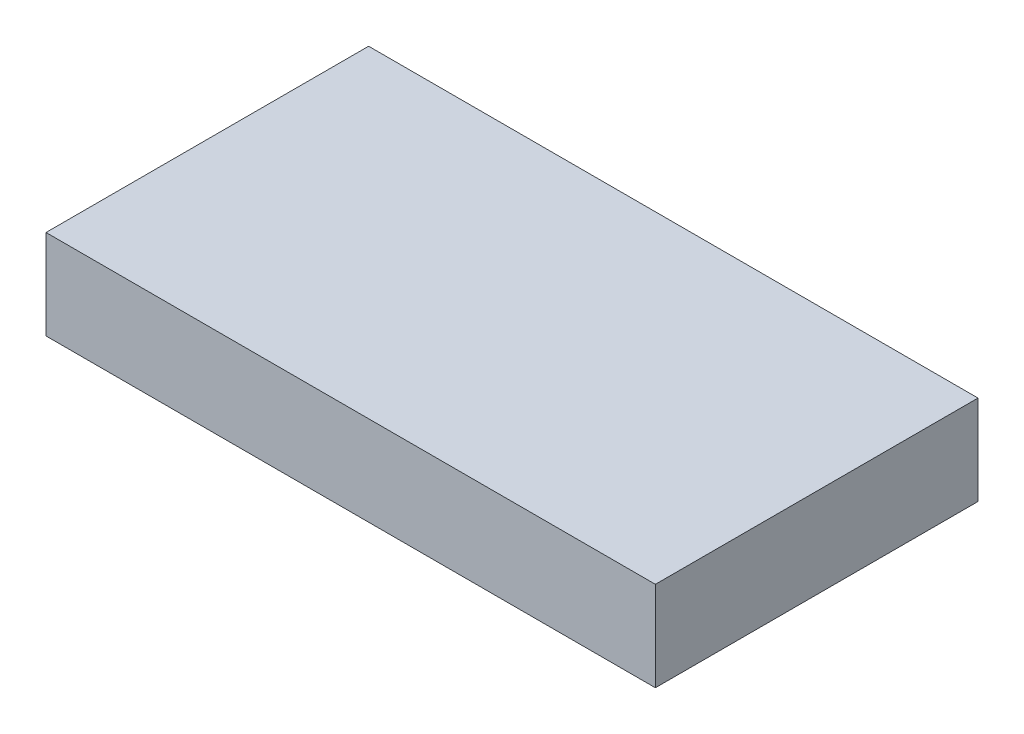
from build123d import *

# Parameters (mm, degrees)
SKETCH1_W           = 215.9
SKETCH1_H           = 114.3
BOSS_EXTRUDE1_DEPTH = 31.75


with BuildPart() as part:
    # Sketch1 → Boss-Extrude1 (new body)
    with BuildSketch(Plane(origin=(0, 0, 0), x_dir=(1, 0, 0), z_dir=(0, 1, 0))):
        Rectangle(SKETCH1_W, SKETCH1_H)
    extrude(amount=BOSS_EXTRUDE1_DEPTH)


solid = part.part
